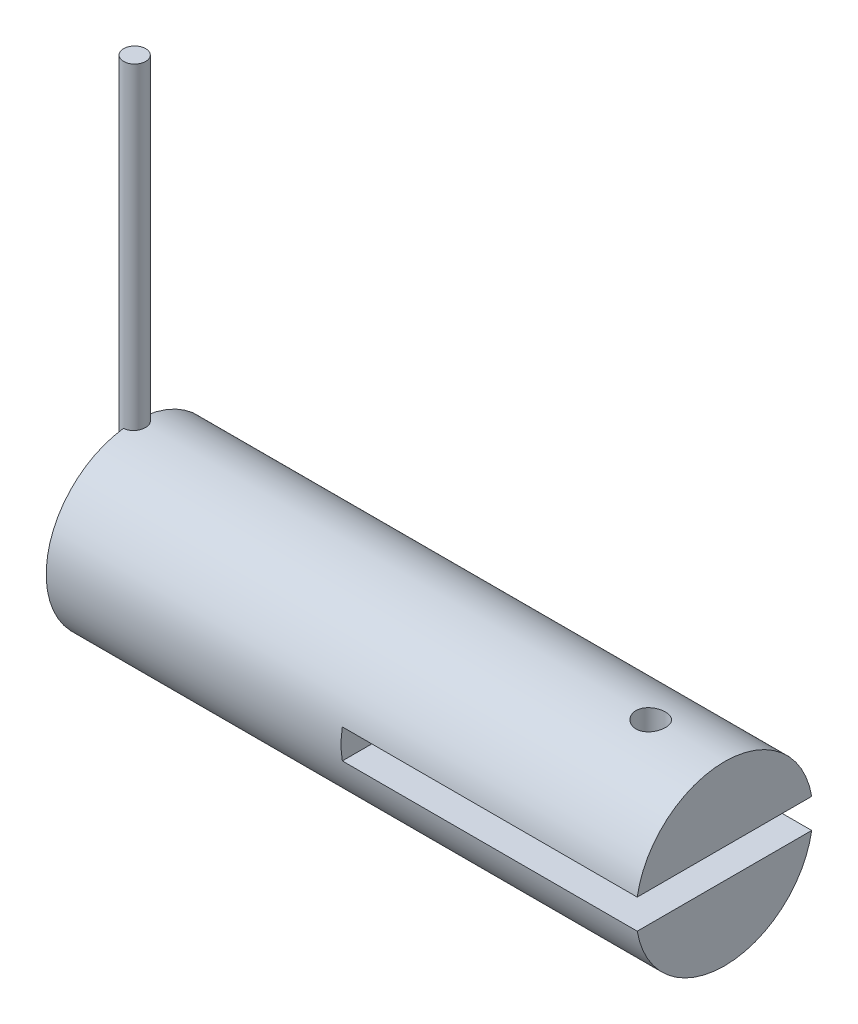
from build123d import *

# Parameters (mm, degrees)
SKETCH_1_R               = 1.5
EXTRUDE_1_DEPTH          = 55
SKETCH_2_R               = 12
EXTRUDE_2_DEPTH          = 80
CUT_EXTRUDE_START        = -40
CUT_EXTRUDE_1_DEPTH      = 40
CUT_EXTRUDE_2_DEPTH      = 97.710909566
CUT_EXTRUDE_2_DEPTH_BACK = 97.710909566
SKETCH_5_R               = 2


with BuildPart() as part:
    # 草图1 → 凸台-拉伸1 (new body)
    with BuildSketch(Plane(origin=(0, 0, 0), x_dir=(1, 0, 0), z_dir=(0, 1, 0))):
        with Locations(Location((0, 0, 0), (0, 0, 270))):
            Circle(SKETCH_1_R)
    extrude(amount=EXTRUDE_1_DEPTH)

    # 草图2 → 凸台-拉伸2 (add)
    with BuildSketch(Plane(origin=(0, 0, 0), x_dir=(0, 0, -1), z_dir=(1, 0, 0))):
        with Locations(Location((0, 0, 0), (0, 0, 97.180755781))):
            Circle(SKETCH_2_R)
    extrude(amount=EXTRUDE_2_DEPTH)

    # 草图4 → 切除-拉伸1 (cut)
    with BuildSketch(Plane(origin=(80, 0, 0), x_dir=(0, 0, -1), z_dir=(1, 0, 0)).offset(CUT_EXTRUDE_START)):
        with BuildLine():
            Line((-11.832159566, -2), (-10.908712115, -2))
            Line((-10.908712115, -2), (10.908712115, -2))
            Line((10.908712115, -2), (11.832159566, -2))
            ThreePointArc((11.832159566, -2), (11.957966273, -1.003515123), (12, 0))
            ThreePointArc((12, 0), (11.957966273, 1.003515123), (11.832159566, 2))
            Line((11.832159566, 2), (-6.712374636, 2))
            Line((-6.712374636, 2), (-11.832159566, 2))
            ThreePointArc((-11.832159566, 2), (-12, 0), (-11.832159566, -2))
        make_face()
    extrude(amount=CUT_EXTRUDE_1_DEPTH, mode=Mode.SUBTRACT)

    # 草图5 → 切除-拉伸2 (cut, two sides: drawn at the far end of the back side and taken through both)
    with BuildSketch(Plane.XZ.offset(-2).offset(-CUT_EXTRUDE_2_DEPTH_BACK)):
        with Locations(Location((70, 0, 0), (0, 0, 270))):
            Circle(SKETCH_5_R)
    extrude(amount=CUT_EXTRUDE_2_DEPTH + CUT_EXTRUDE_2_DEPTH_BACK, mode=Mode.SUBTRACT)


solid = part.part
